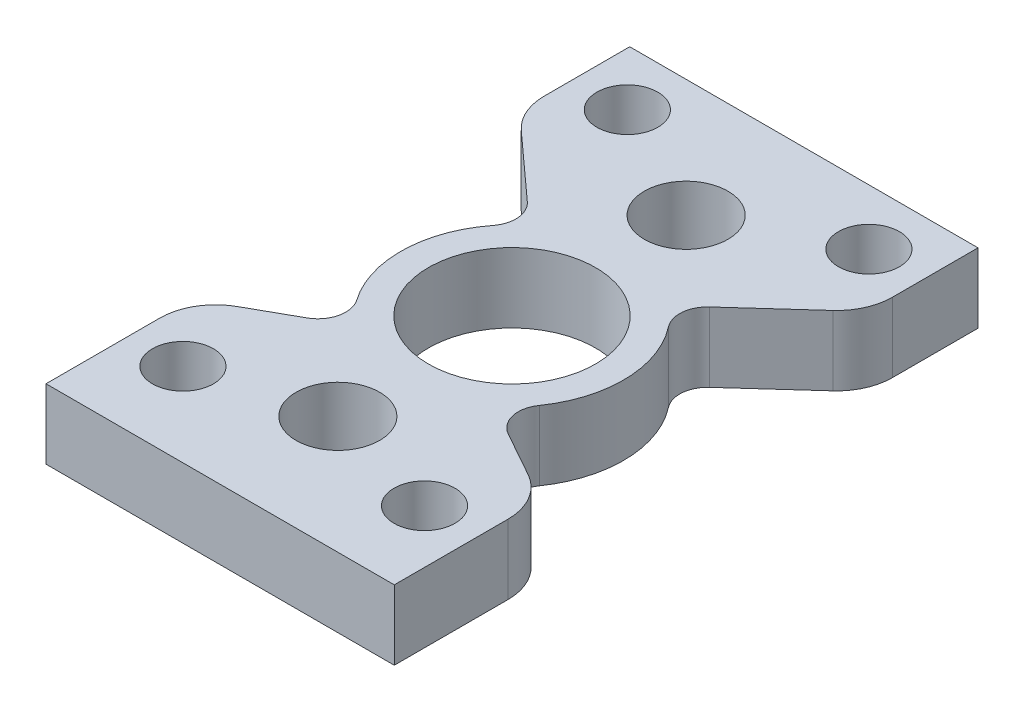
from build123d import *

# Parameters (mm, degrees)
SKETCH1_R           = 2.77876
SKETCH1_R_2         = 7.62
SKETCH1_R_3         = 3.81
BOSS_EXTRUDE1_DEPTH = 6.35


with BuildPart() as part:
    # Sketch1 → Boss-Extrude1 (new body)
    with BuildSketch(Plane(origin=(0, 0, 0), x_dir=(1, 0, 0), z_dir=(0, 1, 0))):
        with BuildLine():
            Line((-15.875, -26.6065), (15.875, -26.6065))
            Line((15.875, -26.6065), (15.875, -16.237330354))
            ThreePointArc((15.875, -16.237330354), (15.176911953, -13.667262721), (13.274508805, -11.803546858))
            Line((13.274508805, -11.803546858), (9.161857046, -9.503624849))
            ThreePointArc((9.161857046, -9.503624849), (7.9255795, -7.853183269), (8.321289158, -5.829386481))
            ThreePointArc((8.321289158, -5.829386481), (10.156557189, 0.264473195), (8.006627428, 6.254559715))
            ThreePointArc((8.006627428, 6.254559715), (7.477616777, 8.035735763), (8.302840532, 9.700501853))
            Line((8.302840532, 9.700501853), (14.205887505, 15.048906872))
            ThreePointArc((14.205887505, 15.048906872), (15.439012733, 16.75449557), (15.875, 18.81351129))
            Line((15.875, 18.81351129), (15.875, 26.6065))
            Line((15.875, 26.6065), (-15.875, 26.6065))
            Line((-15.875, 26.6065), (-15.875, 18.81351129))
            ThreePointArc((-15.875, 18.81351129), (-15.439012733, 16.75449557), (-14.205887505, 15.048906872))
            Line((-14.205887505, 15.048906872), (-8.302840532, 9.700501853))
            ThreePointArc((-8.302840532, 9.700501853), (-7.477616777, 8.035735763), (-8.006627428, 6.254559715))
            ThreePointArc((-8.006627428, 6.254559715), (-10.156557189, 0.264473195), (-8.321289158, -5.829386481))
            ThreePointArc((-8.321289158, -5.829386481), (-7.9255795, -7.853183269), (-9.161857046, -9.503624849))
            Line((-9.161857046, -9.503624849), (-13.274508805, -11.803546858))
            ThreePointArc((-13.274508805, -11.803546858), (-15.176911953, -13.667262721), (-15.875, -16.237330354))
            Line((-15.875, -16.237330354), (-15.875, -26.6065))
        make_face()
        with Locations(Location((11.0109, 21.5265, 0), (0, 0, 270))):
            Circle(SKETCH1_R, mode=Mode.SUBTRACT)
        with Locations(Location((11.0109, -18.9865, 0), (0, 0, 270))):
            Circle(SKETCH1_R, mode=Mode.SUBTRACT)
        with Locations(Location((-11.0109, -18.9865, 0), (0, 0, 90))):
            Circle(SKETCH1_R, mode=Mode.SUBTRACT)
        with Locations(Location((-11.0109, 21.5265, 0), (0, 0, 90))):
            Circle(SKETCH1_R, mode=Mode.SUBTRACT)
        with Locations(Location((0, 0, 0), (0, 0, 270))):
            Circle(SKETCH1_R_2, mode=Mode.SUBTRACT)
        with Locations(Location((0, 15.875, 0), (0, 0, 270))):
            Circle(SKETCH1_R_3, mode=Mode.SUBTRACT)
        with Locations(Location((0, -15.875, 0), (0, 0, 270))):
            Circle(SKETCH1_R_3, mode=Mode.SUBTRACT)
    extrude(amount=BOSS_EXTRUDE1_DEPTH)


solid = part.part
